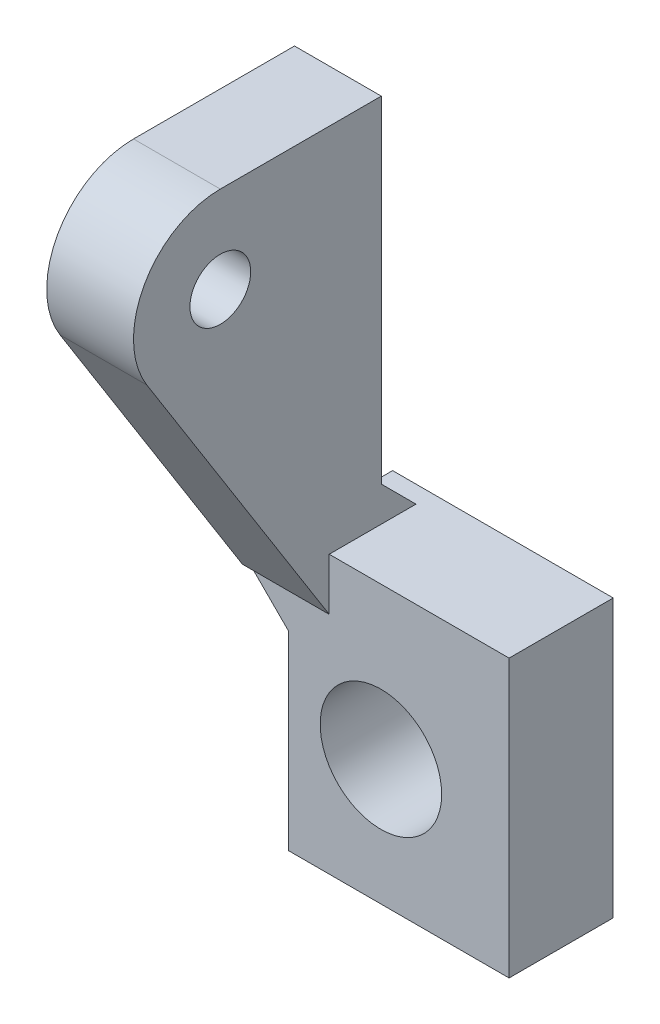
from build123d import *

# Parameters (mm, degrees)
SKETCH1_W           = 12.710924787
SKETCH1_H           = 15.963552005
SKETCH1_R           = 1.8
BOSS_EXTRUDE1_DEPTH = 1
SKETCH2_R           = 1.75
BOSS_EXTRUDE2_DEPTH = 5
SKETCH3_R           = 3.5
BOSS_EXTRUDE3_DEPTH = 5
CHAMFER1_SIZE       = 2


with BuildPart() as part:
    # Sketch1 → Boss-Extrude1 (new body)
    with BuildSketch(Plane.XY.offset(46.41148)):
        with Locations((39.508303211, 7.326783953)):
            Rectangle(SKETCH1_W, SKETCH1_H)
        with Locations((38.478852397, 6.566573863)):
            Circle(SKETCH1_R, mode=Mode.SUBTRACT)
    extrude(amount=BOSS_EXTRUDE1_DEPTH)

    # Sketch2 → Boss-Extrude2 (add)
    with BuildSketch(Plane(origin=(30.5, 0, 0), x_dir=(0, 0, -1), z_dir=(1, 0, 0))):
        with BuildLine():
            Line((-58.687831226, 36.668712622), (-49.41148, 36.668712622))
            Line((-49.41148, 36.668712622), (-49.41148, 17.308559955))
            Line((-49.41148, 17.308559955), (-47.41148, 15.308559955))
            Line((-47.41148, 15.308559955), (-47.41148, 12.308559955))
            Line((-47.41148, 12.308559955), (-52.41148, 12.308559955))
            Line((-52.41148, 12.308559955), (-62.919547885, 29.00552391))
            ThreePointArc((-62.919547885, 29.00552391), (-63.064813266, 34.085741422), (-58.687831226, 36.668712622))
        make_face()
        with Locations((-58.687831226, 31.668712622)):
            Circle(SKETCH2_R, mode=Mode.SUBTRACT)
    extrude(amount=BOSS_EXTRUDE2_DEPTH)

    # Sketch3 → Boss-Extrude3 (add)
    with BuildSketch(Plane.XY.offset(47.41148)):
        Polygon((35.5, 15.308559955), (35.5, 12.308559955), (33.152840817, 12.308559955), (33.152840817, -0.65499205), (45.863765604, -0.65499205), (45.863765604, 15.308559955), align=None)
        with Locations((38.478852397, 6.566573863)):
            Circle(SKETCH3_R, mode=Mode.SUBTRACT)
    extrude(amount=BOSS_EXTRUDE3_DEPTH)

    # Chamfer1
    chamfer1_edges = [part.edges().sort_by_distance(p)[0] for p in [
        (33.152840817, 12.308559955, 49.91148),
    ]]
    chamfer(chamfer1_edges, length=CHAMFER1_SIZE)


solid = part.part
